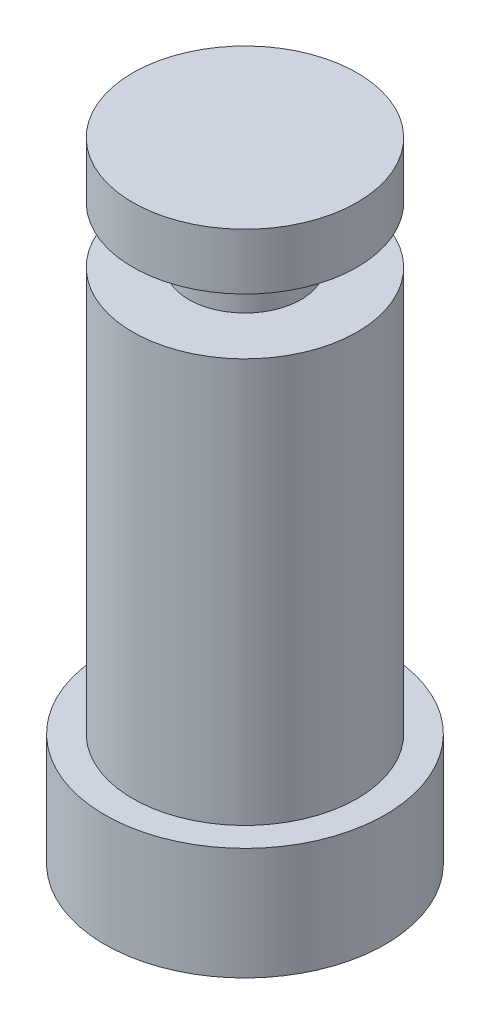
from build123d import *

# Parameters (mm, degrees)
SKETCH2_W = 2.5
SKETCH2_H = 2.5


with BuildPart() as part:
    # Sketch1 → Revolve1 (revolve)
    with BuildSketch(Plane.XY, mode=Mode.PRIVATE) as revolve1_sk:
        Polygon((0, 0), (5, 0), (5, -23), (6.25, -23), (6.25, -28), (0, -28), align=None)
    revolve(revolve1_sk.sketch.rotate(Axis((0, 5, 0), (0, -1, 0)), 180), axis=Axis((0, 5, 0), (0, -1, 0)))

    # Sketch2 → Cut-Revolve1 (revolve, cut)
    with BuildSketch(Plane.XY, mode=Mode.PRIVATE) as cut_revolve1_sk:
        with Locations((3.75, -3.75)):
            Rectangle(SKETCH2_W, SKETCH2_H)
    revolve(cut_revolve1_sk.sketch.rotate(Axis((0, 0, 0), (0, -1, 0)), 180), axis=Axis((0, 0, 0), (0, -1, 0)), mode=Mode.SUBTRACT)


solid = part.part
